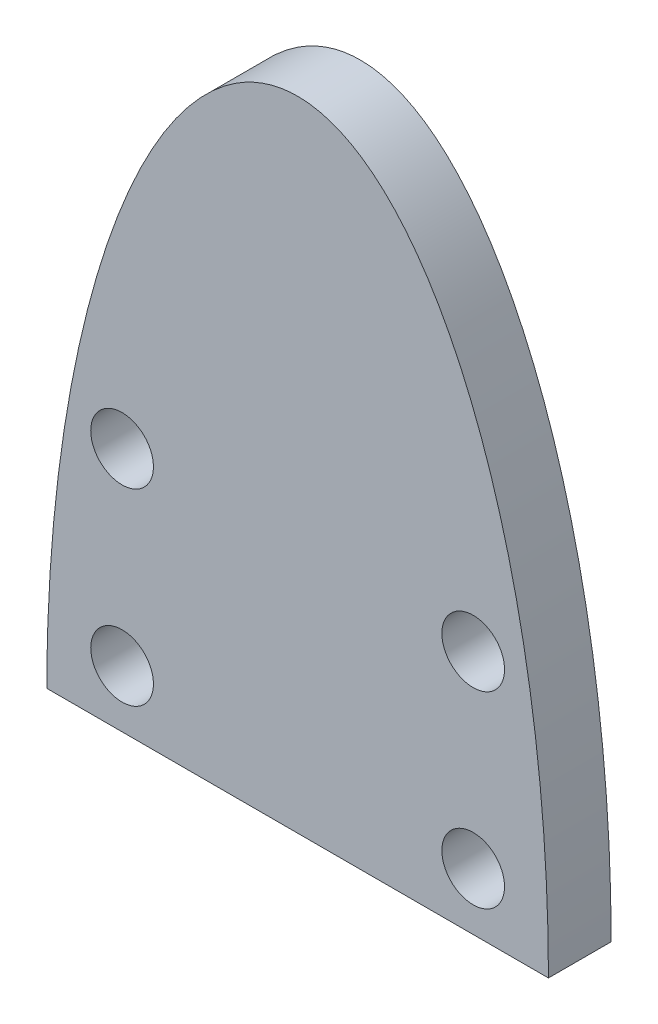
from build123d import *

# Parameters (mm, degrees)
BOSS_EXTRUDE1_DEPTH = 12.7
SKETCH2_R           = 6.35
CUT_EXTRUDE1_DEPTH  = 12.7


with BuildPart() as part:
    # Sketch1 → Boss-Extrude1 (new body)
    with BuildSketch(Plane.XY):
        with BuildLine():
            Line((0, 0), (101.6, 0))
            add(Edge.make_bspline(
                [(101.6, 0), (101.6, 129.286), (50.8, 129.286), (0, 129.286), (0, 0)],
                knots=[4.71238898, 4.71238898, 4.71238898, 6.283185307, 6.283185307, 7.853981634, 7.853981634, 7.853981634], degree=2, weights=[1, 0.707106781, 1, 0.707106781, 1]))
        make_face()
    extrude(amount=BOSS_EXTRUDE1_DEPTH)

    # Sketch2 → Cut-Extrude1 (cut)
    with BuildSketch(Plane(origin=(0, 0, 0), x_dir=(-1, 0, 0), z_dir=(0, 0, -1))):
        with Locations((-86.36, 49.662946304)):
            Circle(SKETCH2_R)
        with Locations((-86.36, 11.562946304)):
            Circle(SKETCH2_R)
        with Locations((-15.24, 49.662946304)):
            Circle(SKETCH2_R)
        with Locations((-15.24, 11.562946304)):
            Circle(SKETCH2_R)
    extrude(amount=-CUT_EXTRUDE1_DEPTH, mode=Mode.SUBTRACT)


solid = part.part
